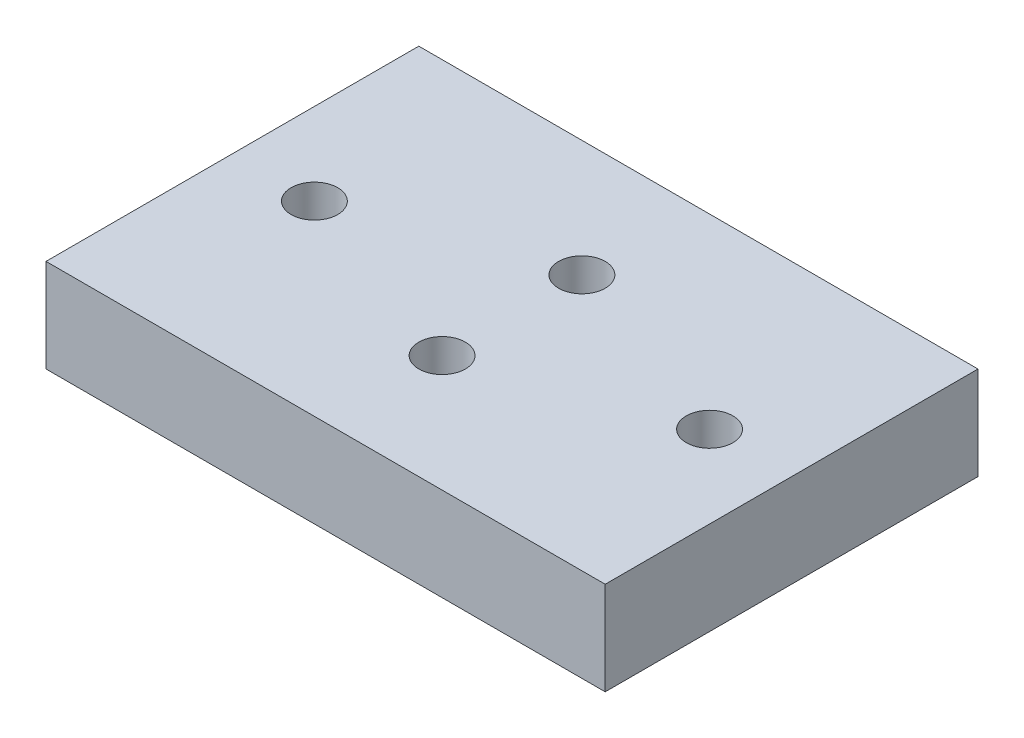
from build123d import *

# Parameters (mm, degrees)
SKETCH1_W           = 60
SKETCH1_H           = 40
SKETCH1_R           = 2.5
BOSS_EXTRUDE1_DEPTH = 10
SKETCH4_R           = 5
CUT_EXTRUDE1_DEPTH  = 5


with BuildPart() as part:
    # Sketch1 → Boss-Extrude1 (new body)
    with BuildSketch(Plane(origin=(0, 0, 0), x_dir=(1, 0, 0), z_dir=(0, 1, 0))):
        with Locations((30, -20)):
            Rectangle(SKETCH1_W, SKETCH1_H)
        with Locations(Location((51.2, -20, 0), (0, 0, 270))):
            Circle(SKETCH1_R, mode=Mode.SUBTRACT)
        with Locations(Location((8.8, -20, 0), (0, 0, 90))):
            Circle(SKETCH1_R, mode=Mode.SUBTRACT)
        with Locations(Location((30, -27.5, 0), (0, 0, 270))):
            Circle(SKETCH1_R, mode=Mode.SUBTRACT)
        with Locations(Location((30, -12.5, 0), (0, 0, 90))):
            Circle(SKETCH1_R, mode=Mode.SUBTRACT)
    extrude(amount=BOSS_EXTRUDE1_DEPTH)

    # Sketch4 → Cut-Extrude1 (cut)
    with BuildSketch(Plane.XZ):
        with Locations(Location((30, 27.5, 0), (0, 0, 270))):
            Circle(SKETCH4_R)
        with Locations(Location((30, 12.5, 0), (0, 0, 270))):
            Circle(SKETCH4_R)
    extrude(amount=-CUT_EXTRUDE1_DEPTH, mode=Mode.SUBTRACT)


solid = part.part
